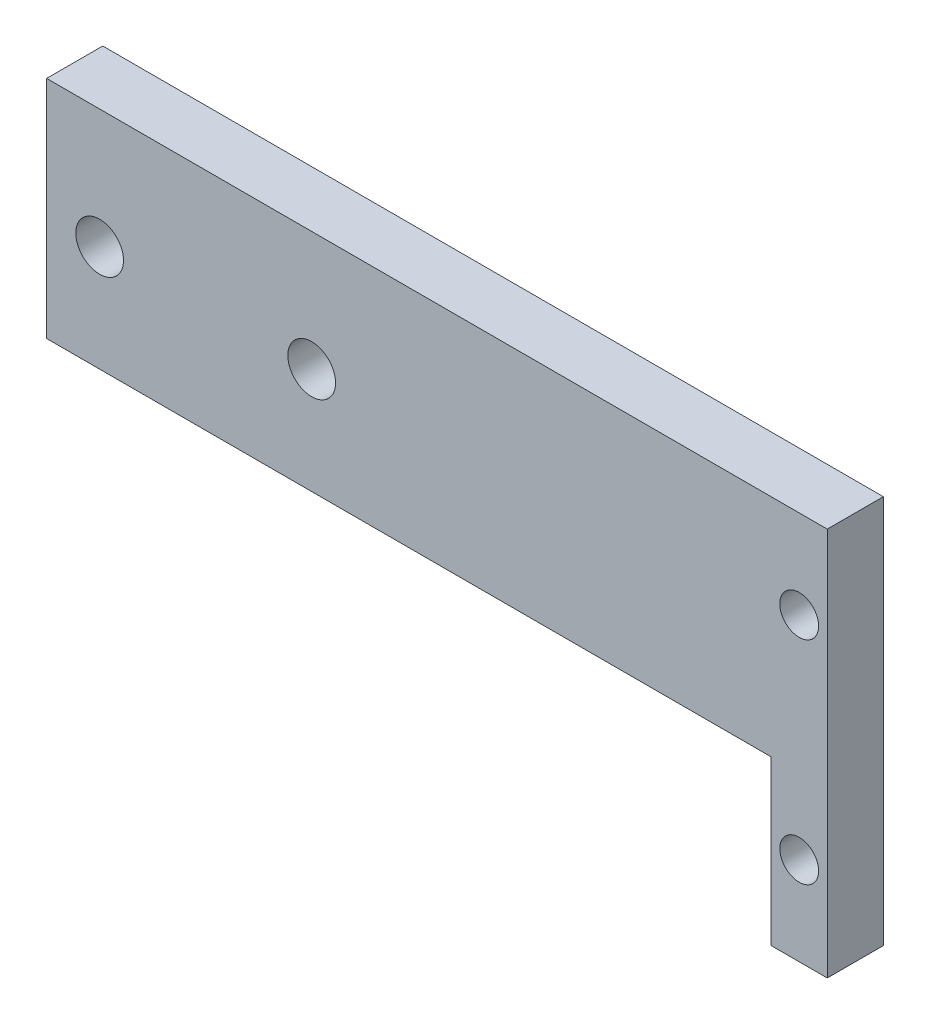
from build123d import *

# Parameters (mm, degrees)
BOSS_EXTRUDE1_DEPTH    = 3.175
M2_5_CLEARANCE_HOLE1_D = 2.7
M2_CLEARANCE_HOLE1_D   = 2.2


with BuildPart() as part:
    # Sketch1 → Boss-Extrude1 (new body)
    with BuildSketch(Plane.XY):
        Polygon((0, 0), (0, 9.25), (-41, 9.25), (-41, 22), (3.175, 22), (3.175, 0), align=None)
    extrude(amount=BOSS_EXTRUDE1_DEPTH)

    # M2.5 Clearance Hole1 (through all)
    with Locations(Plane.XY.offset(3.175)):
        with Locations((-38, 15.25), (-26, 15.25)):
            Hole(M2_5_CLEARANCE_HOLE1_D / 2)

    # M2 Clearance Hole1 (through all)
    with Locations(Plane.XY.offset(3.175)):
        with Locations((1.5875, 17), (1.5875, 5)):
            Hole(M2_CLEARANCE_HOLE1_D / 2)


solid = part.part
